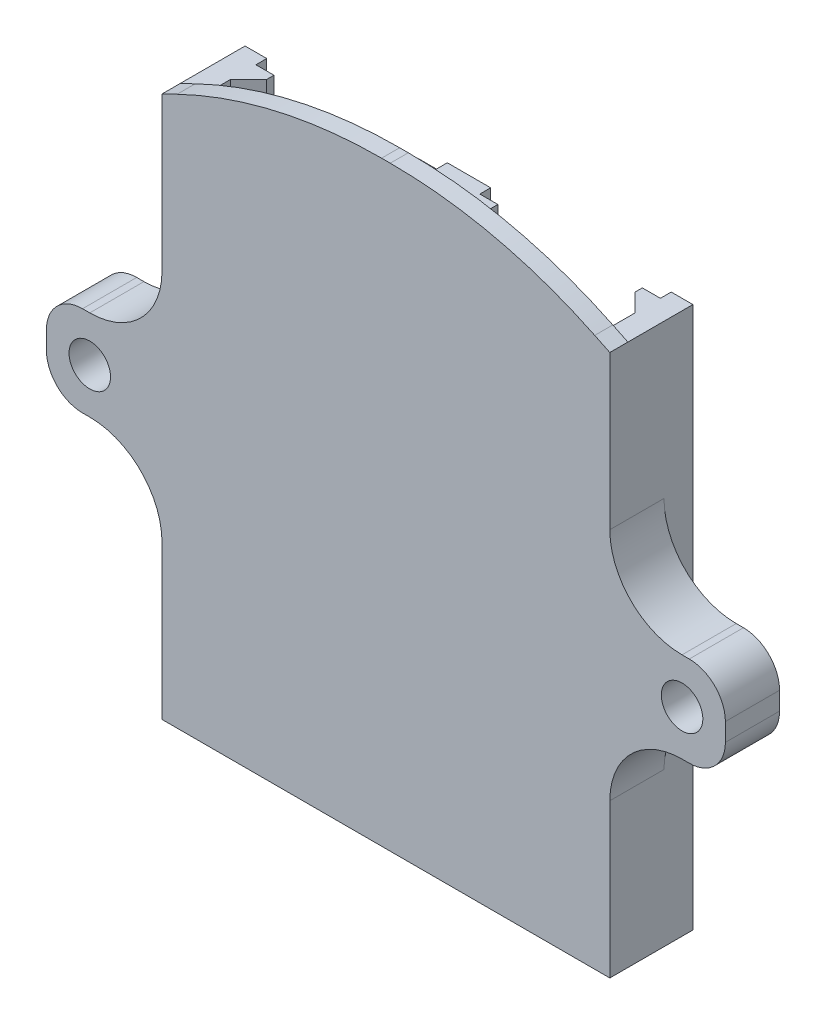
from build123d import *

# Parameters (mm, degrees)
P_IDAT_VYSUNUT_M1_DEPTH = 30
P_IDAT_START            = -2
SKICA2_R                = 1.15
P_IDAT_VYSUNUT_M2_DEPTH = 3
P_IDAT_VYSUNUT_M3_DEPTH = 1


with BuildPart() as part:
    # Skica1 → Přidat vysunutím1 (new body)
    with BuildSketch(Plane(origin=(0, 0, 0), x_dir=(1, 0, 0), z_dir=(0, 1, 0))):
        Polygon((-5, 0), (5, 0), (5, 1.6), (4, 2.6), (4, 3), (5, 3), (5, 3.6), (6.2, 3.6), (6.2, -1), (-6.2, -1), (-6.2, 3.6), (-5, 3.6), (-5, 3), (-4, 3), (-4, 2.6), (-5, 1.6), align=None)
    p_idat_vysunut_m1 = extrude(amount=P_IDAT_VYSUNUT_M1_DEPTH)

    # Skica2 → Přidat vysunutím2 (add)
    with BuildSketch(Plane.XY.offset(P_IDAT_START)):
        with BuildLine():
            Line((-10.2, 17.5), (-10.6, 17.5))
            ThreePointArc((-10.6, 17.5), (-12.014213562, 16.914213562), (-12.6, 15.5))
            Line((-12.6, 15.5), (-12.6, 14.5))
            ThreePointArc((-12.6, 14.5), (-12.014213562, 13.085786438), (-10.6, 12.5))
            Line((-10.6, 12.5), (-10.2, 12.5))
            ThreePointArc((-10.2, 12.5), (-7.371572875, 11.328427125), (-6.2, 8.5))
            Line((-6.2, 8.5), (-6.2, 21.5))
            ThreePointArc((-6.2, 21.5), (-7.371572875, 18.671572875), (-10.2, 17.5))
        make_face()
        with Locations((-10.2, 15)):
            Circle(SKICA2_R, mode=Mode.SUBTRACT)
    p_idat_vysunut_m2 = extrude(amount=P_IDAT_VYSUNUT_M2_DEPTH)

    # Skica3 → Přidat vysunutím3 (add)
    with BuildSketch(Plane.XY.offset(1)):
        with BuildLine():
            Line((-6.2, 30), (6.2, 30))
            Line((6.2, 30), (6.2, 33))
            Line((6.2, 33), (5.959807907, 33))
            ThreePointArc((5.959807907, 33), (0.150662271, 32.3427273), (-5.364776224, 30.404140537))
            Line((-5.364776224, 30.404140537), (-6.2, 30))
        make_face()
    p_idat_vysunut_m3 = extrude(amount=-P_IDAT_VYSUNUT_M3_DEPTH)

    # Zrcadlit2: Přidat vysunutím1, Přidat vysunutím2, Přidat vysunutím3 across plane
    add(p_idat_vysunut_m1.mirror(Plane(origin=(6.2, 30, -3.6), x_dir=(0, 0, 1), z_dir=(-1, 0, 0))))
    add(p_idat_vysunut_m2.mirror(Plane(origin=(6.2, 30, -3.6), x_dir=(0, 0, 1), z_dir=(-1, 0, 0))))
    add(p_idat_vysunut_m3.mirror(Plane(origin=(6.2, 30, -3.6), x_dir=(0, 0, 1), z_dir=(-1, 0, 0))))


solid = part.part
